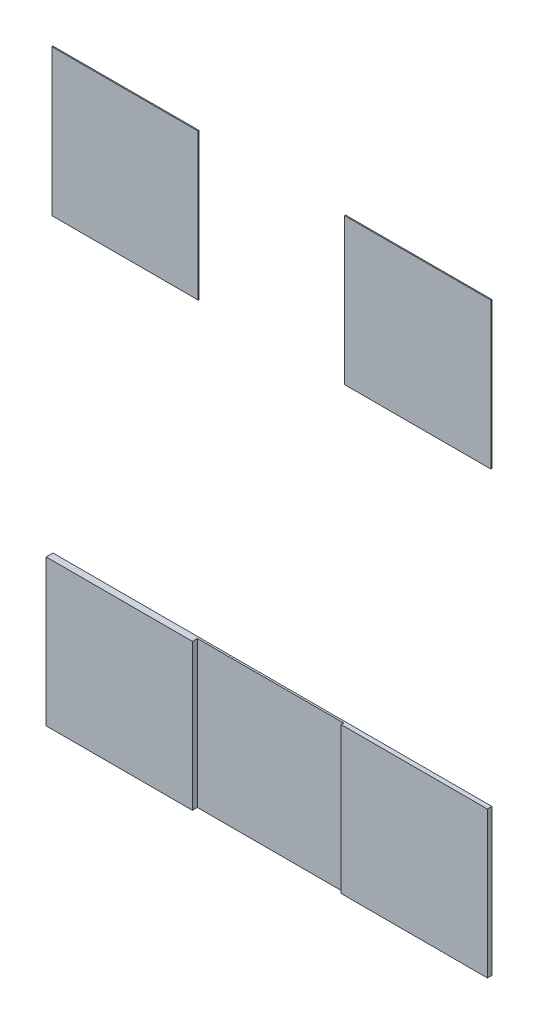
from build123d import *

# Parameters (mm, degrees)
SKETCH_1_W      = 460
SKETCH_1_H      = 460
EXTRUDE_1_DEPTH = 21.4200203
SKETCH_2_W      = 460
SKETCH_2_H      = 460
EXTRUDE_2_DEPTH = 5.8470921
SKETCH_3_W      = 460
SKETCH_3_H      = 460
EXTRUDE_3_DEPTH = 14.156868
SKETCH_13_W     = 460
SKETCH_13_H     = 460
EXTRUDE_4_DEPTH = 3.4007521
SKETCH_15_W     = 460
SKETCH_15_H     = 460
EXTRUDE_5_DEPTH = 3.4007521


with BuildPart() as part:
    # 草图1 → 凸台-拉伸1 (new body)
    with BuildSketch(Plane.XY):
        with Locations((690, 690)):
            Rectangle(SKETCH_1_W, SKETCH_1_H)
    extrude(amount=EXTRUDE_1_DEPTH)

    # 草图2 → 凸台-拉伸2 (add)
    with BuildSketch(Plane.XY):
        with Locations((1150, 690)):
            Rectangle(SKETCH_2_W, SKETCH_2_H)
    extrude(amount=EXTRUDE_2_DEPTH)

    # 草图3 → 凸台-拉伸3 (add)
    with BuildSketch(Plane.XY):
        with Locations((1610, 690)):
            Rectangle(SKETCH_3_W, SKETCH_3_H)
    extrude(amount=EXTRUDE_3_DEPTH)


with BuildPart() as body_2:
    # 草图13 → 凸台-拉伸4 (new body)
    with BuildSketch(Plane.XY):
        with Locations((690, 2070)):
            Rectangle(SKETCH_13_W, SKETCH_13_H)
    extrude(amount=EXTRUDE_4_DEPTH)


with BuildPart() as body_3:
    # 草图15 → 凸台-拉伸5 (new body)
    with BuildSketch(Plane.XY):
        with Locations((1610, 2070)):
            Rectangle(SKETCH_15_W, SKETCH_15_H)
    extrude(amount=EXTRUDE_5_DEPTH)


solid = Compound([part.part, body_2.part, body_3.part])
